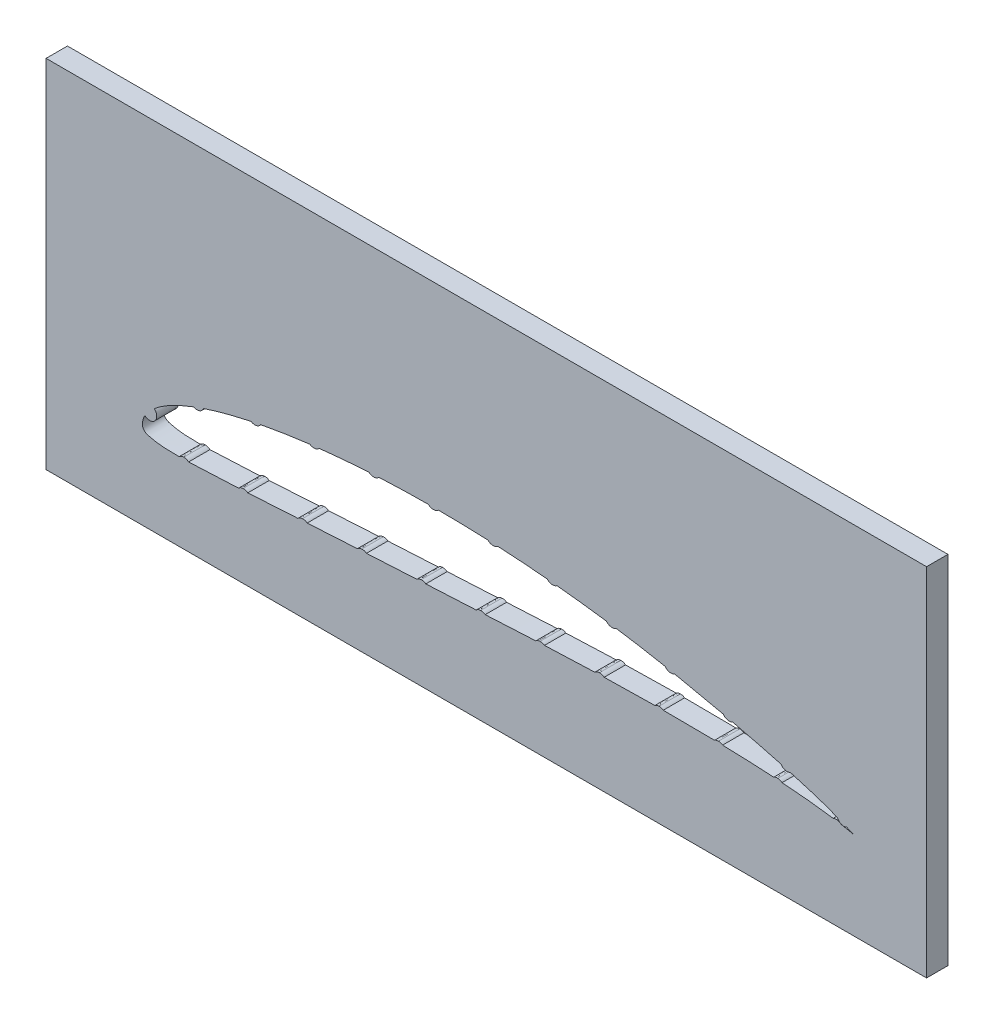
from build123d import *

# Parameters (mm, degrees)
SKETCH1_W           = 123.588543324
SKETCH1_H           = 50
BOSS_EXTRUDE2_DEPTH = 3
BOSS_EXTRUDE3_DEPTH = 3


with BuildPart() as part:
    # Sketch1 → Boss-Extrude2 (new body)
    with BuildSketch(Plane.XY):
        with Locations((218.267470168, 12.712423786)):
            Rectangle(SKETCH1_W, SKETCH1_H)
        with BuildLine():
            add(Edge.make_bspline(
                [(270, 0), (270.000531877, 0.003373113), (269.604790207, 0.130553943), (269.22472915, 0.296319344), (268.330865705, 0.649903004), (267.277186336, 1.081299428), (265.934274474, 1.592378679), (264.356085493, 2.13119545), (262.522264286, 2.690841421), (260.448213128, 3.281482663), (258.145825293, 3.901894754), (255.634156952, 4.543144793), (252.932846836, 5.198513494), (250.062314569, 5.858396716), (247.044177544, 6.51364444), (243.900590389, 7.151425674), (240.650956991, 7.760247697), (237.307066187, 8.31354205), (233.883595001, 8.806992825), (230.395260372, 9.240605966), (226.857180843, 9.602232354), (223.286591659, 9.896529908), (219.700248717, 10.117752504), (216.116964643, 10.261648713), (212.554817959, 10.334332115), (209.031451169, 10.328468466), (205.565142749, 10.247425168), (202.173482908, 10.093982453), (198.874572309, 9.868492566), (195.685665982, 9.575778452), (192.623683519, 9.217477093), (189.705290136, 8.796693592), (186.94527157, 8.320164438), (184.358265565, 7.789238681), (181.957578066, 7.210464766), (179.75475726, 6.590183358), (177.761781016, 5.931774723), (175.98567804, 5.247260918), (174.435455816, 4.534482769), (173.118173599, 3.799644912), (172.026756653, 3.064647529), (171.17127049, 2.318986898), (170.547770141, 1.590030804), (170.137458117, 0.884733652), (169.989560721, 0.227724311), (169.994733097, -0.383168635), (170.433396723, -0.862595631), (171.182072829, -1.059855632), (172.185532941, -1.264671848), (173.519915035, -1.359625351), (175.16301488, -1.38233033), (177.124973282, -1.338955474), (179.395715412, -1.244778023), (181.961254721, -1.11276071), (184.802106724, -0.95191893), (187.897230746, -0.767235246), (191.224075506, -0.567304184), (194.758064713, -0.356082726), (198.473361552, -0.140100109), (202.342623123, 0.077746338), (206.337292513, 0.293927277), (210.428851317, 0.506514505), (214.590287779, 0.719951626), (218.799226957, 0.941524586), (223.037430772, 1.162141782), (227.283652269, 1.371889531), (231.508516957, 1.545991012), (235.674820818, 1.672738516), (239.74464394, 1.755832522), (243.683325041, 1.792300885), (247.457889827, 1.78094482), (251.035666014, 1.722193168), (254.384683977, 1.617830293), (257.474550853, 1.472101348), (260.275209312, 1.290626327), (262.762715442, 1.080839711), (264.903324746, 0.855693179), (266.699603634, 0.617770387), (268.055136746, 0.401348582), (269.136474082, 0.181419843), (269.578077714, 0.103267656), (269.999462825, -0.003406717), (270, 0)],
                knots=[0, 0, 0, 0, 0.000978925, 0.003785915, 0.008178786, 0.013939636, 0.020914584, 0.029056598, 0.038413559, 0.048973972, 0.060645419, 0.073333851, 0.086939075, 0.101355023, 0.116470865, 0.132170767, 0.148332165, 0.164889948, 0.181806831, 0.198986829, 0.216369093, 0.233891214, 0.251455205, 0.268989944, 0.286410199, 0.30363306, 0.320588513, 0.33718727, 0.353353473, 0.369012335, 0.384083455, 0.398499749, 0.412191497, 0.425098469, 0.437171363, 0.448351495, 0.458605679, 0.467900991, 0.476215593, 0.483572991, 0.489970137, 0.495456444, 0.500131703, 0.503991848, 0.507230008, 0.509986767, 0.512500662, 0.516073685, 0.521095012, 0.527571392, 0.53558732, 0.545177111, 0.556301643, 0.568874715, 0.582800206, 0.597975202, 0.614286016, 0.631612678, 0.649825892, 0.668791608, 0.688371086, 0.708416853, 0.728796853, 0.749399049, 0.770145767, 0.790953093, 0.811664203, 0.832074041, 0.851999344, 0.871281672, 0.889760566, 0.907279934, 0.923686414, 0.93883251, 0.952579327, 0.964796492, 0.975364982, 0.984179192, 0.991107071, 0.996049394, 0.999011322, 1, 1, 1, 1], degree=3))
        make_face(mode=Mode.SUBTRACT)
    extrude(amount=BOSS_EXTRUDE2_DEPTH)

    # Sketch3 → Boss-Extrude3 (add)
    with BuildSketch(Plane.XY.offset(3)):
        with BuildLine():
            add(Edge.make_bspline(
                [(268.857308454, 2.303163111), (268.91819139, 2.275372315), (269.037830567, 2.220761481), (269.188402994, 2.093748198), (269.311683636, 1.941123122), (269.403448818, 1.764361273), (269.464568337, 1.574112157), (269.484143416, 1.376897811), (269.463271716, 1.178070249), (269.416998779, 1.052427732), (269.393366146, 0.988259265)],
                knots=[0, 0, 0, 0, 1.012081854, 1.988810785, 2.957856305, 3.975553384, 4.995284697, 5.973452278, 6.96499636, 8, 8, 8, 8], degree=3))
            add(Edge.make_bspline(
                [(269.393366146, 0.988259265), (269.364470212, 0.927575015), (269.308059731, 0.809107559), (269.183374926, 0.655606495), (269.029791525, 0.532103245), (268.852843041, 0.440033561), (268.663451384, 0.379024091), (268.46892997, 0.356330989), (268.27290157, 0.375807249), (268.149126007, 0.418365385), (268.085673839, 0.440182341)],
                knots=[0, 0, 0, 0, 1.022759203, 1.99662485, 2.987685297, 4.0104445, 5.023584258, 6.007909155, 6.978776747, 8, 8, 8, 8], degree=3))
            add(Edge.make_bspline(
                [(268.085673839, 0.440182341), (268.024858938, 0.468915894), (267.905677284, 0.52522631), (267.75373868, 0.652709948), (267.629590541, 0.806083896), (267.536470997, 0.983329193), (267.478741892, 1.1752859), (267.459337867, 1.371090048), (267.477324594, 1.568255205), (267.521912152, 1.691697127), (267.544808454, 1.755086188)],
                knots=[0, 0, 0, 0, 1.018905117, 1.996793456, 2.984119269, 4.003024386, 5.020399341, 6.011849183, 6.979058234, 8, 8, 8, 8], degree=3))
            add(Edge.make_bspline(
                [(267.544808454, 1.755086188), (267.574644724, 1.816487888), (267.633206371, 1.937005124), (267.757865991, 2.093165685), (267.9110445, 2.219158761), (268.0884646, 2.310781404), (268.277881191, 2.371636), (268.473512288, 2.391735414), (268.669540403, 2.370105791), (268.793884038, 2.325775053), (268.857308454, 2.303163111)],
                knots=[0, 0, 0, 0, 1.032958572, 2.027457061, 3.003065255, 4.019594588, 5.038155821, 6.003109628, 6.981438767, 8, 8, 8, 8], degree=3))
        make_face()
        with BuildLine():
            add(Edge.make_bspline(
                [(260.754051269, 5.000651016), (260.816781439, 4.978984283), (260.940584814, 4.936223125), (261.106600422, 4.83152613), (261.244088529, 4.691610026), (261.354851334, 4.527598847), (261.438216247, 4.34618228), (261.479530121, 4.152728215), (261.480182032, 3.953473503), (261.449836098, 3.823986178), (261.434339731, 3.757862555)],
                knots=[0, 0, 0, 0, 1.008745825, 1.990846472, 2.957578748, 3.976685275, 4.993009952, 5.979425217, 6.968179124, 8, 8, 8, 8], degree=3))
            add(Edge.make_bspline(
                [(261.434339731, 3.757862555), (261.412817767, 3.694259582), (261.370576145, 3.569424658), (261.264505578, 3.402732027), (261.12547897, 3.263223468), (260.962038828, 3.149355535), (260.780138236, 3.067685856), (260.589217387, 3.022547519), (260.392153631, 3.019693192), (260.264102838, 3.04846813), (260.198762808, 3.063151016)],
                knots=[0, 0, 0, 0, 1.021235543, 2.004400996, 2.980860545, 4.008001129, 5.025427718, 6.003644384, 6.981326609, 8, 8, 8, 8], degree=3))
            add(Edge.make_bspline(
                [(260.198762808, 3.063151016), (260.135163114, 3.085531859), (260.011239348, 3.129140848), (259.844933901, 3.23605512), (259.707218052, 3.37615138), (259.594332209, 3.540905186), (259.515539064, 3.724874722), (259.473878292, 3.917406717), (259.469998257, 4.114918031), (259.498912622, 4.242991648), (259.513666654, 4.308343324)],
                knots=[0, 0, 0, 0, 1.02422911, 1.995706581, 2.979369884, 3.998132512, 5.020397056, 6.006479454, 6.982773251, 8, 8, 8, 8], degree=3))
            add(Edge.make_bspline(
                [(259.513666654, 4.308343324), (259.536186438, 4.372652734), (259.580280606, 4.498571788), (259.685093191, 4.66787202), (259.824311154, 4.808058023), (259.989211273, 4.918594492), (260.170517652, 5.002387115), (260.363209608, 5.04240894), (260.560854521, 5.047383003), (260.688729721, 5.016451519), (260.754051269, 5.000651016)],
                knots=[0, 0, 0, 0, 1.033077547, 2.022785576, 2.995503267, 4.011805204, 5.025332947, 6.009033588, 6.982969271, 8, 8, 8, 8], degree=3))
        make_face()
        with BuildLine():
            add(Edge.make_bspline(
                [(252.583229116, 7.076790794), (252.647443863, 7.057555753), (252.773670516, 7.019745516), (252.945666386, 6.922135896), (253.08881602, 6.787835684), (253.209100734, 6.630142473), (253.29768104, 6.452410142), (253.346977381, 6.261757516), (253.357725723, 6.063449193), (253.333564024, 5.932306841), (253.321209885, 5.865252332)],
                knots=[0, 0, 0, 0, 1.01808493, 2.00124515, 2.97658461, 3.986309412, 5.006145636, 5.976287325, 6.965253734, 8, 8, 8, 8], degree=3))
            add(Edge.make_bspline(
                [(253.321209885, 5.865252332), (253.302194424, 5.800887056), (253.265013221, 5.675032707), (253.164824234, 5.505646368), (253.034940126, 5.358001156), (252.874760322, 5.237926411), (252.697136411, 5.146175683), (252.50728611, 5.093908111), (252.310235069, 5.083664832), (252.180721901, 5.107744083), (252.114479116, 5.120060025)],
                knots=[0, 0, 0, 0, 1.019133022, 1.992725439, 2.969984308, 3.997852915, 5.024198162, 5.99847909, 6.976271501, 8, 8, 8, 8], degree=3))
            add(Edge.make_bspline(
                [(252.114479116, 5.120060025), (252.050052567, 5.13895852), (251.92474481, 5.175715542), (251.756262829, 5.277233024), (251.610407324, 5.407473615), (251.493196968, 5.569637409), (251.408317814, 5.750223877), (251.355127125, 5.940312451), (251.344842853, 6.137489401), (251.369014526, 6.266165526), (251.381306039, 6.331598486)],
                knots=[0, 0, 0, 0, 1.021315902, 1.986429638, 2.973923132, 3.989360908, 5.018122711, 6.006297939, 6.986184684, 8, 8, 8, 8], degree=3))
            add(Edge.make_bspline(
                [(251.381306039, 6.331598486), (251.400572733, 6.396575743), (251.438435004, 6.524266898), (251.535205894, 6.698490363), (251.670316089, 6.841968701), (251.827448469, 6.961771627), (252.004224355, 7.050655228), (252.192768019, 7.102990466), (252.389108524, 7.113259181), (252.517792277, 7.089084059), (252.583229116, 7.076790794)],
                knots=[0, 0, 0, 0, 1.032464466, 2.028965024, 3.006987829, 4.019490577, 5.031180752, 6.00713739, 6.986611552, 8, 8, 8, 8], degree=3))
        make_face()
        with BuildLine():
            add(Edge.make_bspline(
                [(244.367056173, 8.838395658), (244.431974217, 8.821587782), (244.559121029, 8.788668308), (244.734586392, 8.698073184), (244.882574294, 8.56895987), (245.007436307, 8.413853177), (245.099407078, 8.236982448), (245.161235775, 8.048775643), (245.174360031, 7.849624938), (245.15551179, 7.718001623), (245.145902327, 7.650895658)],
                knots=[0, 0, 0, 0, 1.017037865, 1.991944219, 2.967990593, 3.98159658, 5.000164099, 5.982268228, 6.971292906, 8, 8, 8, 8], degree=3))
            add(Edge.make_bspline(
                [(245.145902327, 7.650895658), (245.129345869, 7.585832209), (245.096826238, 7.458036803), (245.002046726, 7.283812167), (244.874557347, 7.132703085), (244.719279419, 7.007118404), (244.545786729, 6.909664703), (244.3578865, 6.854491638), (244.162304494, 6.832022771), (244.031995726, 6.852170479), (243.965613866, 6.862434119)],
                knots=[0, 0, 0, 0, 1.019544405, 2.002554324, 2.990327538, 4.014101528, 5.030205597, 5.999477124, 6.98089414, 8, 8, 8, 8], degree=3))
            add(Edge.make_bspline(
                [(243.965613866, 6.862434119), (243.900427471, 6.87879686), (243.773077596, 6.910763545), (243.601586848, 7.007453507), (243.448225133, 7.130602373), (243.32661188, 7.289625063), (243.231518471, 7.466206534), (243.176121615, 7.656053254), (243.157110349, 7.853374477), (243.176754759, 7.983571426), (243.186767712, 8.049934119)],
                knots=[0, 0, 0, 0, 1.018198843, 1.989180332, 2.967860581, 3.992171291, 5.011901535, 6.003255219, 6.982239123, 8, 8, 8, 8], degree=3))
            add(Edge.make_bspline(
                [(243.186767712, 8.049934119), (243.203305045, 8.115803417), (243.235779095, 8.245149721), (243.330204649, 8.420517361), (243.455031231, 8.57348442), (243.611597388, 8.697276608), (243.78747213, 8.789231578), (243.974043509, 8.850553298), (244.170611118, 8.867689371), (244.300732167, 8.848285835), (244.367056173, 8.838395658)],
                knots=[0, 0, 0, 0, 1.029383351, 2.021380768, 2.999587737, 4.013860053, 5.033097165, 6.004220827, 6.982731304, 8, 8, 8, 8], degree=3))
        make_face()
        with BuildLine():
            add(Edge.make_bspline(
                [(236.064273131, 10.250935141), (236.129996129, 10.237611793), (236.258442035, 10.211573275), (236.436356565, 10.126392393), (236.592355078, 10.006583929), (236.722771552, 9.855017928), (236.8262947, 9.684027813), (236.893303129, 9.497926905), (236.918372617, 9.299949457), (236.903596433, 9.167533107), (236.8960039, 9.099492833)],
                knots=[0, 0, 0, 0, 1.014931213, 1.983533345, 2.964055081, 3.981389191, 5.00155579, 5.982681017, 6.963429105, 8, 8, 8, 8], degree=3))
            add(Edge.make_bspline(
                [(236.8960039, 9.099492833), (236.882542452, 9.033840586), (236.856087961, 8.904820517), (236.77231449, 8.725307764), (236.650781526, 8.569179712), (236.501083176, 8.435737128), (236.329038874, 8.333908018), (236.145123695, 8.262769642), (235.949212932, 8.23587301), (235.818225142, 8.249055277), (235.751773131, 8.255742833)],
                knots=[0, 0, 0, 0, 1.016417799, 1.997468461, 2.979426383, 4.006303523, 5.027964377, 6.003249458, 6.98701939, 8, 8, 8, 8], degree=3))
            add(Edge.make_bspline(
                [(235.751773131, 8.255742833), (235.685986293, 8.269832911), (235.557259983, 8.297403225), (235.380298711, 8.385457581), (235.223514988, 8.504714266), (235.093647289, 8.656620655), (234.9882002, 8.827468538), (234.927288892, 9.015310106), (234.897079678, 9.211108975), (234.910664386, 9.34225905), (234.917638515, 9.409588987)],
                knots=[0, 0, 0, 0, 1.018889088, 1.993678927, 2.97513822, 3.993445086, 5.01458715, 6.004170248, 6.97537923, 8, 8, 8, 8], degree=3))
            add(Edge.make_bspline(
                [(234.917638515, 9.409588987), (234.931841548, 9.476118685), (234.959780028, 9.606987821), (235.046234796, 9.786564127), (235.164157192, 9.945655105), (235.316104694, 10.075244668), (235.486340645, 10.178184666), (235.671308803, 10.246356157), (235.866963225, 10.270177609), (235.99782984, 10.257414962), (236.064273131, 10.250935141)],
                knots=[0, 0, 0, 0, 1.029942136, 2.025976994, 2.999384555, 4.016962166, 5.037372944, 6.007276013, 6.988258845, 8, 8, 8, 8], degree=3))
        make_face()
        with BuildLine():
            add(Edge.make_bspline(
                [(227.677139671, 11.255114558), (227.742825795, 11.245197617), (227.871607989, 11.225754767), (228.050468642, 11.146712024), (228.212855226, 11.038427248), (228.346762153, 10.892506175), (228.458882801, 10.729516834), (228.531621436, 10.546573992), (228.570795189, 10.351948741), (228.561611968, 10.219185888), (228.556947364, 10.151749174)],
                knots=[0, 0, 0, 0, 1.011967132, 1.984031631, 2.963102508, 3.97744202, 4.993852823, 5.972540036, 6.970154417, 8, 8, 8, 8], degree=3))
            add(Edge.make_bspline(
                [(228.556947364, 10.151749174), (228.547152926, 10.085221545), (228.528060753, 9.955540092), (228.447916874, 9.775612483), (228.340483865, 9.611280349), (228.19438642, 9.475113774), (228.032575538, 9.360784781), (227.851572601, 9.287931836), (227.660289051, 9.248922001), (227.529851997, 9.256202065), (227.463197364, 9.259922251)],
                knots=[0, 0, 0, 0, 1.025326729, 1.998656239, 2.989165282, 4.013316177, 5.037908168, 6.006506537, 6.98130499, 8, 8, 8, 8], degree=3))
            add(Edge.make_bspline(
                [(227.463197364, 9.259922251), (227.396741568, 9.270761901), (227.26734874, 9.291867254), (227.087285126, 9.37045509), (226.925200546, 9.479877957), (226.787733304, 9.624271033), (226.677678159, 9.790128688), (226.603241809, 9.972164786), (226.568546795, 10.165746935), (226.57519922, 10.296698654), (226.578581979, 10.363287635)],
                knots=[0, 0, 0, 0, 1.025589576, 1.996875291, 2.97516177, 3.997162156, 5.022971071, 6.000874194, 6.983444043, 8, 8, 8, 8], degree=3))
            add(Edge.make_bspline(
                [(226.578581979, 10.363287635), (226.589582149, 10.430461124), (226.611119114, 10.561978462), (226.687694259, 10.745464793), (226.798671529, 10.907678245), (226.940286665, 11.045851912), (227.10441135, 11.156847919), (227.286341937, 11.229434316), (227.479319727, 11.269015421), (227.610500678, 11.259797299), (227.677139671, 11.255114558)],
                knots=[0, 0, 0, 0, 1.035250362, 2.026891483, 3.002977376, 4.013929038, 5.027241016, 6.002944416, 6.985509923, 8, 8, 8, 8], degree=3))
        make_face()
        with BuildLine():
            add(Edge.make_bspline(
                [(219.281392129, 11.869580378), (219.347690114, 11.862838474), (219.478782443, 11.849507571), (219.662825313, 11.779775248), (219.829037668, 11.675408234), (219.972901039, 11.538993422), (220.094656457, 11.37975887), (220.176672003, 11.198947938), (220.222821404, 11.004108536), (220.220222748, 10.870622854), (220.218892129, 10.802272686)],
                knots=[0, 0, 0, 0, 1.008322197, 1.993775624, 2.955893755, 3.971675897, 4.988841592, 5.979688237, 6.965517146, 8, 8, 8, 8], degree=3))
            add(Edge.make_bspline(
                [(220.218892129, 10.802272686), (220.212177574, 10.735961216), (220.198900751, 10.604842222), (220.128527916, 10.420351802), (220.02480676, 10.252413657), (219.889124968, 10.105909433), (219.729443431, 9.985031315), (219.550829189, 9.901941918), (219.358984032, 9.85682263), (219.227932504, 9.857311971), (219.161199821, 9.857561148)],
                knots=[0, 0, 0, 0, 1.011814065, 2.000680165, 2.976496362, 4.004750697, 5.025438885, 6.008635918, 6.985978499, 8, 8, 8, 8], degree=3))
            add(Edge.make_bspline(
                [(219.161199821, 9.857561148), (219.095000936, 9.865465694), (218.965244063, 9.880959448), (218.779841468, 9.947382934), (218.614895376, 10.054069569), (218.468423273, 10.189774894), (218.352139689, 10.352318764), (218.267847418, 10.530260508), (218.223022005, 10.722321524), (218.223471125, 10.853343509), (218.223699821, 10.920061148)],
                knots=[0, 0, 0, 0, 1.015388815, 1.990270343, 2.97423849, 3.995282884, 5.020347872, 6.005227664, 6.984242983, 8, 8, 8, 8], degree=3))
            add(Edge.make_bspline(
                [(218.223699821, 10.920061148), (218.231609479, 10.987855999), (218.247112087, 11.120731171), (218.312804476, 11.309045822), (218.417345164, 11.476932284), (218.554269738, 11.62123315), (218.713063371, 11.742201719), (218.891784932, 11.825175781), (219.083602147, 11.870325099), (219.214657499, 11.869831648), (219.281392129, 11.869580378)],
                knots=[0, 0, 0, 0, 1.034626547, 2.027826264, 3.000679092, 4.016883515, 5.034472066, 6.014683315, 6.989057891, 8, 8, 8, 8], degree=3))
        make_face()
        with BuildLine():
            add(Edge.make_bspline(
                [(210.850616037, 12.060053954), (210.917504228, 12.055387826), (211.048009775, 12.046283746), (211.236210276, 11.989331274), (211.406713501, 11.893405673), (211.55728221, 11.763734795), (211.680804036, 11.608233903), (211.776509514, 11.435610031), (211.826846099, 11.242311969), (211.833021433, 11.109191284), (211.83619296, 11.040823184)],
                knots=[0, 0, 0, 0, 1.018387724, 1.986976232, 2.964434224, 3.976593219, 4.991981267, 5.974298486, 6.959640553, 8, 8, 8, 8], degree=3))
            add(Edge.make_bspline(
                [(211.83619296, 11.040823184), (211.831555736, 10.973919611), (211.822508048, 10.843384052), (211.764940715, 10.654724004), (211.669740517, 10.482320007), (211.539807874, 10.329792889), (211.386266813, 10.203275112), (211.213103795, 10.111424693), (211.024607363, 10.056638854), (210.893447435, 10.050940129), (210.826577575, 10.048034723)],
                knots=[0, 0, 0, 0, 1.021154089, 1.992373686, 2.983189672, 4.007415787, 5.033247389, 6.001690304, 6.981192721, 8, 8, 8, 8], degree=3))
            add(Edge.make_bspline(
                [(210.826577575, 10.048034723), (210.759606046, 10.052439054), (210.62870093, 10.06104793), (210.441464835, 10.121859492), (210.270317102, 10.216818344), (210.120293247, 10.346990616), (209.994832279, 10.501873507), (209.90548164, 10.677290307), (209.849424887, 10.866745039), (209.843845312, 10.997962469), (209.841000652, 11.064861646)],
                knots=[0, 0, 0, 0, 1.021460431, 1.996585683, 2.976992887, 3.992205795, 5.010657499, 6.00109082, 6.980887083, 8, 8, 8, 8], degree=3))
            add(Edge.make_bspline(
                [(209.841000652, 11.064861646), (209.845594196, 11.133362144), (209.854506479, 11.26626517), (209.911778165, 11.457506078), (210.006904607, 11.630191337), (210.13735309, 11.781178592), (210.292418985, 11.903933325), (210.462876532, 12.000424602), (210.653133761, 12.050480669), (210.783858277, 12.056817759), (210.850616037, 12.060053954)],
                knots=[0, 0, 0, 0, 1.042672751, 2.022968706, 3.011126506, 4.023312124, 5.038726881, 6.010331962, 6.983926002, 8, 8, 8, 8], degree=3))
        make_face()
        with BuildLine():
            add(Edge.make_bspline(
                [(202.417979309, 11.826563664), (202.484786782, 11.826219032), (202.616333064, 11.825540438), (202.806324677, 11.775165833), (202.982225703, 11.688739921), (203.138104165, 11.566028641), (203.272781412, 11.419292555), (203.373914037, 11.24943259), (203.438486966, 11.060883956), (203.45037396, 10.928025733), (203.456440847, 10.860217511)],
                knots=[0, 0, 0, 0, 1.013395961, 1.995412564, 2.960779728, 3.977984359, 4.996869055, 5.975699992, 6.966837105, 8, 8, 8, 8], degree=3))
            add(Edge.make_bspline(
                [(203.456440847, 10.860217511), (203.456121875, 10.793399603), (203.455493808, 10.661832776), (203.404563588, 10.471288433), (203.318742382, 10.293671169), (203.196774443, 10.136191043), (203.050706851, 10.000208406), (202.88355955, 9.897904003), (202.697345517, 9.832156874), (202.566748737, 9.820518637), (202.499710078, 9.814544434)],
                knots=[0, 0, 0, 0, 1.015588309, 1.999729374, 2.978162138, 4.007265433, 5.019317663, 6.006565314, 6.976719118, 8, 8, 8, 8], degree=3))
            add(Edge.make_bspline(
                [(202.499710078, 9.814544434), (202.432913642, 9.814913513), (202.301389093, 9.815640242), (202.110189421, 9.865940549), (201.934047182, 9.954492725), (201.777443179, 10.07754388), (201.641137927, 10.223804347), (201.546097674, 10.395627444), (201.478456226, 10.580620843), (201.467085449, 10.71136991), (201.461248539, 10.778486741)],
                knots=[0, 0, 0, 0, 1.015226607, 1.999017171, 2.982504237, 4.001546395, 5.022271652, 6.007275275, 6.97708356, 8, 8, 8, 8], degree=3))
            add(Edge.make_bspline(
                [(201.461248539, 10.778486741), (201.461537468, 10.84689556), (201.462103094, 10.980817689), (201.512582365, 11.173994447), (201.598640265, 11.35109925), (201.719244263, 11.508933986), (201.866206745, 11.642917421), (202.034770466, 11.742863728), (202.220278435, 11.809078152), (202.350918454, 11.820632515), (202.417979309, 11.826563664)],
                knots=[0, 0, 0, 0, 1.037168643, 2.030437559, 3.006202568, 4.015421778, 5.033726636, 6.012000531, 6.979509154, 8, 8, 8, 8], degree=3))
        make_face()
        with BuildLine():
            add(Edge.make_bspline(
                [(193.955212157, 11.143162179), (194.021750666, 11.147342657), (194.15166347, 11.155504812), (194.345022925, 11.123683849), (194.525162849, 11.048352923), (194.692059785, 10.941724951), (194.836160657, 10.804425517), (194.951932764, 10.645156171), (195.028143535, 10.46100912), (195.051417304, 10.330477151), (195.063385234, 10.263354486)],
                knots=[0, 0, 0, 0, 1.015414257, 1.982540864, 2.95913311, 3.976901612, 4.98906984, 5.980030657, 6.961283373, 8, 8, 8, 8], degree=3))
            add(Edge.make_bspline(
                [(195.063385234, 10.263354486), (195.067525252, 10.196815518), (195.075657608, 10.066111144), (195.04389645, 9.871231898), (194.968698618, 9.688602672), (194.861843254, 9.519685044), (194.726515335, 9.373084226), (194.566470894, 9.260537105), (194.387828635, 9.179875457), (194.258880779, 9.158737728), (194.193192926, 9.147969871)],
                knots=[0, 0, 0, 0, 1.016345316, 1.996435784, 2.985278933, 4.014299292, 5.036305514, 6.011106652, 6.986829732, 8, 8, 8, 8], degree=3))
            add(Edge.make_bspline(
                [(194.193192926, 9.147969871), (194.126655907, 9.14384284), (193.995955363, 9.135735996), (193.801789488, 9.167190395), (193.620105851, 9.242474234), (193.454045484, 9.352163675), (193.309891319, 9.490467173), (193.198147148, 9.651640761), (193.11645781, 9.831410575), (193.095670351, 9.961252669), (193.085019849, 10.027777563)],
                knots=[0, 0, 0, 0, 1.015512743, 1.994800338, 2.971487305, 3.996020487, 5.016749877, 6.000762099, 6.975685884, 8, 8, 8, 8], degree=3))
            add(Edge.make_bspline(
                [(193.085019849, 10.027777563), (193.079410816, 10.095997671), (193.068510748, 10.228570202), (193.106286564, 10.423768345), (193.175208345, 10.607036359), (193.285170739, 10.772075222), (193.420996938, 10.915148328), (193.578547372, 11.032431246), (193.761008978, 11.107033864), (193.889755963, 11.130985128), (193.955212157, 11.143162179)],
                knots=[0, 0, 0, 0, 1.040004898, 2.021047546, 3.004297608, 4.011584217, 5.023535757, 6.004349767, 6.985392415, 8, 8, 8, 8], degree=3))
        make_face()
        with BuildLine():
            add(Edge.make_bspline(
                [(185.591222589, 9.805177253), (185.657586202, 9.815420881), (185.787068244, 9.835407223), (185.982332252, 9.813602267), (186.168538229, 9.754835005), (186.342477691, 9.658233484), (186.497638079, 9.533096965), (186.623793824, 9.380800781), (186.71471013, 9.204001947), (186.747536225, 9.075252567), (186.764299513, 9.009504176)],
                knots=[0, 0, 0, 0, 1.019042273, 1.988253323, 2.96107011, 3.97711078, 5.000820892, 5.980733335, 6.96882195, 8, 8, 8, 8], degree=3))
            add(Edge.make_bspline(
                [(186.764299513, 9.009504176), (186.773181734, 8.943150433), (186.790618201, 8.812893065), (186.774051407, 8.616590137), (186.713178002, 8.429241054), (186.618000583, 8.25462699), (186.494839762, 8.098212465), (186.344201609, 7.972648863), (186.171132623, 7.878259658), (186.043316047, 7.845761328), (185.97824182, 7.829215714)],
                knots=[0, 0, 0, 0, 1.019508912, 2.001372377, 2.975823716, 4.004310757, 5.022058604, 5.994206091, 6.978806251, 8, 8, 8, 8], degree=3))
            add(Edge.make_bspline(
                [(185.97824182, 7.829215714), (185.911845624, 7.819968281), (185.782222857, 7.80191487), (185.586494003, 7.823429614), (185.399034295, 7.881350527), (185.224957726, 7.978871202), (185.068008746, 8.102798723), (184.948025298, 8.259368569), (184.850986328, 8.431352848), (184.820606348, 8.559668746), (184.805164897, 8.624888791)],
                knots=[0, 0, 0, 0, 1.018824193, 1.989011705, 2.974466676, 3.991530988, 5.016272468, 5.998996802, 6.982935689, 8, 8, 8, 8], degree=3))
            add(Edge.make_bspline(
                [(184.805164897, 8.624888791), (184.794894854, 8.692077047), (184.774730003, 8.82399871), (184.797306553, 9.021883254), (184.851831011, 9.21165556), (184.949908428, 9.385753318), (185.074675439, 9.540154346), (185.224563642, 9.666937395), (185.398689045, 9.758435938), (185.526217439, 9.789395971), (185.591222589, 9.805177253)],
                knots=[0, 0, 0, 0, 1.030001708, 2.022370363, 3.002151597, 4.017033193, 5.039575484, 6.008985142, 6.985118403, 8, 8, 8, 8], degree=3))
        make_face()
        with BuildLine():
            add(Edge.make_bspline(
                [(177.324022904, 7.525462819), (177.388396364, 7.544404793), (177.514538198, 7.581522193), (177.710756817, 7.586749631), (177.903284766, 7.555824888), (178.086097385, 7.481618032), (178.257045297, 7.380979603), (178.401177838, 7.246440777), (178.514821597, 7.08356133), (178.565087508, 6.960916821), (178.590849827, 6.898058973)],
                knots=[0, 0, 0, 0, 1.020740959, 2.000174248, 2.967614024, 3.978630612, 4.994152611, 5.980969911, 6.965205307, 8, 8, 8, 8], degree=3))
            add(Edge.make_bspline(
                [(178.590849827, 6.898058973), (178.609783789, 6.833692338), (178.646885487, 6.70756388), (178.652248295, 6.510449989), (178.620462333, 6.317065518), (178.550737482, 6.131146852), (178.448525671, 5.960938346), (178.316157793, 5.816484026), (178.157560346, 5.69940349), (178.035320373, 5.651051097), (177.973061365, 5.626424357)],
                knots=[0, 0, 0, 0, 1.021791598, 2.002233008, 2.982750905, 4.001896892, 5.018464159, 5.997987266, 6.98033905, 8, 8, 8, 8], degree=3))
            add(Edge.make_bspline(
                [(177.973061365, 5.626424357), (177.908639464, 5.60848744), (177.783002578, 5.573506504), (177.587159666, 5.5674873), (177.39394272, 5.59870054), (177.208564758, 5.671755069), (177.038113291, 5.775136648), (176.897026566, 5.911550141), (176.779015757, 6.069123752), (176.730794428, 6.19149986), (176.706234442, 6.253828203)],
                knots=[0, 0, 0, 0, 1.019560782, 1.988367927, 2.969497438, 3.993614118, 5.017217438, 5.996738476, 6.97970302, 8, 8, 8, 8], degree=3))
            add(Edge.make_bspline(
                [(176.706234442, 6.253828203), (176.687582052, 6.319022248), (176.651007662, 6.446857468), (176.641696195, 6.645280488), (176.673705966, 6.840255534), (176.747173257, 7.024775569), (176.847448183, 7.196622509), (176.983372965, 7.336375573), (177.140393022, 7.453033972), (177.26170458, 7.5008827), (177.324022904, 7.525462819)],
                knots=[0, 0, 0, 0, 1.0322296, 2.024039123, 3.003175911, 4.025212558, 5.040347938, 6.017879519, 6.981775295, 8, 8, 8, 8], degree=3))
        make_face()
        with BuildLine():
            add(Edge.make_bspline(
                [(170.194519118, 2.555370385), (170.236647443, 2.606952558), (170.319034962, 2.707828329), (170.475126849, 2.825705381), (170.651931123, 2.908851768), (170.844903303, 2.955231149), (171.043714144, 2.968184773), (171.239630982, 2.942171921), (171.426067478, 2.873320269), (171.537083507, 2.801195177), (171.59355758, 2.764505001)],
                knots=[0, 0, 0, 0, 1.013973166, 1.98295882, 2.95710545, 3.977846359, 4.995135459, 5.983089641, 6.973993736, 8, 8, 8, 8], degree=3))
            add(Edge.make_bspline(
                [(171.59355758, 2.764505001), (171.646235425, 2.722625553), (171.749304524, 2.64068452), (171.865650542, 2.480588963), (171.952333411, 2.303610323), (171.997080108, 2.109169169), (172.014928262, 1.911274025), (171.985943082, 1.717980809), (171.924756507, 1.531862566), (171.851935321, 1.423342449), (171.814711426, 1.367870385)],
                knots=[0, 0, 0, 0, 1.02396448, 2.003481677, 2.994713637, 4.01625956, 5.03516051, 6.011765435, 6.983677152, 8, 8, 8, 8], degree=3))
            add(Edge.make_bspline(
                [(171.814711426, 1.367870385), (171.77252033, 1.316373951), (171.689296499, 1.21479492), (171.532333413, 1.094835601), (171.352985837, 1.0124804), (171.159638767, 0.965846786), (170.961136755, 0.951432937), (170.767275833, 0.98300865), (170.5806836, 1.046113754), (170.471201077, 1.119242151), (170.415672964, 1.156331924)],
                knots=[0, 0, 0, 0, 1.013564952, 1.99930241, 2.984129115, 4.004459085, 5.021338636, 5.998542729, 6.984886888, 8, 8, 8, 8], degree=3))
            add(Edge.make_bspline(
                [(170.415672964, 1.156331924), (170.363270862, 1.199252384), (170.26075891, 1.283215811), (170.141245444, 1.441222797), (170.055045095, 1.618273688), (170.005694093, 1.811178623), (169.99305246, 2.009676971), (170.020330956, 2.204000027), (170.084535267, 2.390328024), (170.157508197, 2.499831597), (170.194519118, 2.555370385)],
                knots=[0, 0, 0, 0, 1.02919371, 2.013366866, 2.990852128, 4.012558579, 5.027824409, 6.001718911, 6.986497806, 8, 8, 8, 8], degree=3))
        make_face()
        with BuildLine():
            add(Edge.make_bspline(
                [(175.839971178, -3.117304511), (175.773045339, -3.115497029), (175.641715246, -3.111950165), (175.453570967, -3.055119774), (175.278434376, -2.967968614), (175.12364754, -2.842661749), (174.995168045, -2.690552419), (174.898126082, -2.518105713), (174.839025038, -2.327766115), (174.830091902, -2.194635977), (174.825548101, -2.126919896)],
                knots=[0, 0, 0, 0, 1.014678471, 1.991126599, 2.961771574, 3.976743051, 4.997775421, 5.974832402, 6.969907072, 8, 8, 8, 8], degree=3))
            add(Edge.make_bspline(
                [(174.825548101, -2.126919896), (174.827317734, -2.059973021), (174.830790326, -1.928601648), (174.888371576, -1.740066726), (174.973937136, -1.563205405), (175.100873653, -1.408979022), (175.249526924, -1.277522641), (175.418615392, -1.178098865), (175.606161927, -1.118540522), (175.736984292, -1.109771529), (175.803913486, -1.105285281)],
                knots=[0, 0, 0, 0, 1.018549086, 1.998721994, 2.98400179, 4.002844999, 5.026455867, 6.002646806, 6.978146908, 8, 8, 8, 8], degree=3))
            add(Edge.make_bspline(
                [(175.803913486, -1.105285281), (175.870816897, -1.107141453), (176.002102982, -1.110783862), (176.190921908, -1.167025365), (176.365576647, -1.257317004), (176.519728436, -1.384601494), (176.648450938, -1.537431162), (176.747513602, -1.707351357), (176.807537892, -1.895500709), (176.816272005, -2.026332192), (176.820740409, -2.09326605)],
                knots=[0, 0, 0, 0, 1.016734348, 1.995160892, 2.973358556, 3.998063399, 5.021164519, 6.006205468, 6.979967532, 8, 8, 8, 8], degree=3))
            add(Edge.make_bspline(
                [(176.820740409, -2.09326605), (176.818948935, -2.161774756), (176.815453621, -2.29544092), (176.759038802, -2.487402343), (176.669293244, -2.663430221), (176.543906452, -2.818448015), (176.394164236, -2.947707295), (176.224640607, -3.044107251), (176.037787577, -3.104182973), (175.906922317, -3.112863515), (175.839971178, -3.117304511)],
                knots=[0, 0, 0, 0, 1.039375622, 2.027907958, 3.015310844, 4.030646385, 5.04275304, 6.009523282, 6.981664938, 8, 8, 8, 8], degree=3))
        make_face()
        with BuildLine():
            add(Edge.make_bspline(
                [(184.237302611, -2.759311341), (184.170517818, -2.759797468), (184.039178386, -2.760753489), (183.848616884, -2.712298117), (183.67080684, -2.629052853), (183.512862484, -2.508404668), (183.374373279, -2.364705074), (183.274826892, -2.193564267), (183.206981314, -2.006026211), (183.193628738, -1.872866681), (183.186821842, -1.804984418)],
                knots=[0, 0, 0, 0, 1.011688187, 1.989592912, 2.959499061, 3.977838594, 4.994792978, 5.972470081, 6.966402781, 8, 8, 8, 8], degree=3))
            add(Edge.make_bspline(
                [(183.186821842, -1.804984418), (183.186304453, -1.738187024), (183.185286953, -1.606822814), (183.234372648, -1.415732461), (183.316400888, -1.236641494), (183.437526209, -1.077717722), (183.582569387, -0.941223611), (183.748429419, -0.8342885), (183.934708318, -0.768105711), (184.065333962, -0.75429248), (184.131533381, -0.74729211)],
                knots=[0, 0, 0, 0, 1.014505969, 1.995134382, 2.978801155, 3.999976997, 5.019763831, 6.002520082, 6.987702522, 8, 8, 8, 8], degree=3))
            add(Edge.make_bspline(
                [(184.131533381, -0.74729211), (184.198298099, -0.746854866), (184.329598051, -0.74599498), (184.520786735, -0.793834611), (184.698212718, -0.880214149), (184.85526437, -1.003040076), (184.994672791, -1.146567518), (185.092781312, -1.316712632), (185.162346948, -1.501110931), (185.175348437, -1.632072641), (185.18201415, -1.699215187)],
                knots=[0, 0, 0, 0, 1.014531168, 1.995183938, 2.973094045, 4.001647616, 5.02145978, 6.001884288, 6.975589297, 8, 8, 8, 8], degree=3))
            add(Edge.make_bspline(
                [(185.18201415, -1.699215187), (185.18256519, -1.767609283), (185.183642648, -1.901341574), (185.134938442, -2.094976646), (185.052449363, -2.274856546), (184.931088253, -2.433319209), (184.787732222, -2.570981266), (184.618849247, -2.671381135), (184.434323746, -2.738814304), (184.303567976, -2.752417443), (184.237302611, -2.759311341)],
                knots=[0, 0, 0, 0, 1.035884002, 2.025483881, 3.006275766, 4.024467094, 5.041273474, 6.008357966, 6.990661087, 8, 8, 8, 8], degree=3))
        make_face()
        with BuildLine():
            add(Edge.make_bspline(
                [(192.569480106, -2.261674357), (192.502695313, -2.262160484), (192.371355881, -2.263116506), (192.180794379, -2.214661133), (192.002984335, -2.13141587), (191.845039979, -2.010767684), (191.706550774, -1.867068091), (191.607004387, -1.695927283), (191.539158809, -1.508389227), (191.525806233, -1.375229697), (191.518999337, -1.307347434)],
                knots=[0, 0, 0, 0, 1.011688187, 1.989592912, 2.959499061, 3.977838594, 4.994792978, 5.972470081, 6.966402781, 8, 8, 8, 8], degree=3))
            add(Edge.make_bspline(
                [(191.518999337, -1.307347434), (191.518481948, -1.240550041), (191.517464448, -1.10918583), (191.566550143, -0.918095477), (191.648578383, -0.73900451), (191.769703704, -0.580080738), (191.914746882, -0.443586627), (192.080606914, -0.336651516), (192.266885813, -0.270468727), (192.397511457, -0.256655496), (192.463710876, -0.249655126)],
                knots=[0, 0, 0, 0, 1.014505969, 1.995134382, 2.978801155, 3.999976997, 5.019763831, 6.002520082, 6.987702522, 8, 8, 8, 8], degree=3))
            add(Edge.make_bspline(
                [(192.463710876, -0.249655126), (192.530475594, -0.249217883), (192.661775545, -0.248357996), (192.85296423, -0.296197627), (193.030390213, -0.382577165), (193.187441865, -0.505403093), (193.326850286, -0.648930534), (193.424958807, -0.819075649), (193.494524443, -1.003473948), (193.507525932, -1.134435657), (193.514191645, -1.201578203)],
                knots=[0, 0, 0, 0, 1.014531168, 1.995183938, 2.973094045, 4.001647616, 5.02145978, 6.001884288, 6.975589297, 8, 8, 8, 8], degree=3))
            add(Edge.make_bspline(
                [(193.514191645, -1.201578203), (193.514742685, -1.2699723), (193.515820143, -1.40370459), (193.467115937, -1.597339662), (193.384626858, -1.777219562), (193.263265748, -1.935682225), (193.119909716, -2.073344282), (192.951026742, -2.173744152), (192.766501241, -2.24117732), (192.635745471, -2.254780459), (192.569480106, -2.261674357)],
                knots=[0, 0, 0, 0, 1.035884002, 2.025483881, 3.006275766, 4.024467094, 5.041273474, 6.008357966, 6.990661087, 8, 8, 8, 8], degree=3))
        make_face()
        with BuildLine():
            add(Edge.make_bspline(
                [(200.903087941, -1.78806139), (200.836303148, -1.788547517), (200.704963716, -1.789503538), (200.514402214, -1.741048166), (200.33659217, -1.657802902), (200.178647814, -1.537154717), (200.040158609, -1.393455123), (199.940612222, -1.222314316), (199.872766644, -1.03477626), (199.859414068, -0.90161673), (199.852607172, -0.833734466)],
                knots=[0, 0, 0, 0, 1.011688187, 1.989592912, 2.959499061, 3.977838594, 4.994792978, 5.972470081, 6.966402781, 8, 8, 8, 8], degree=3))
            add(Edge.make_bspline(
                [(199.852607172, -0.833734466), (199.852089783, -0.766937073), (199.851072283, -0.635572863), (199.900157978, -0.44448251), (199.982186218, -0.265391543), (200.103311539, -0.106467771), (200.248354717, 0.03002634), (200.414214749, 0.136961451), (200.600493648, 0.20314424), (200.731119292, 0.216957471), (200.797318711, 0.223957841)],
                knots=[0, 0, 0, 0, 1.014505969, 1.995134382, 2.978801155, 3.999976997, 5.019763831, 6.002520082, 6.987702522, 8, 8, 8, 8], degree=3))
            add(Edge.make_bspline(
                [(200.797318711, 0.223957841), (200.864083429, 0.224395085), (200.99538338, 0.225254971), (201.186572065, 0.17741534), (201.363998048, 0.091035802), (201.5210497, -0.031790125), (201.660458121, -0.175317566), (201.758566642, -0.345462681), (201.828132278, -0.52986098), (201.841133767, -0.660822689), (201.84779948, -0.727965236)],
                knots=[0, 0, 0, 0, 1.014531168, 1.995183938, 2.973094045, 4.001647616, 5.02145978, 6.001884288, 6.975589297, 8, 8, 8, 8], degree=3))
            add(Edge.make_bspline(
                [(201.84779948, -0.727965236), (201.84835052, -0.796359332), (201.849427978, -0.930091623), (201.800723772, -1.123726695), (201.718234693, -1.303606594), (201.596873583, -1.462069257), (201.453517551, -1.599731314), (201.284634577, -1.700131184), (201.100109076, -1.767564353), (200.969353306, -1.781167491), (200.903087941, -1.78806139)],
                knots=[0, 0, 0, 0, 1.035884002, 2.025483881, 3.006275766, 4.024467094, 5.041273474, 6.008357966, 6.990661087, 8, 8, 8, 8], degree=3))
        make_face()
        with BuildLine():
            add(Edge.make_bspline(
                [(209.238545311, -1.34878483), (209.171760517, -1.349270958), (209.040421085, -1.350226979), (208.849859583, -1.301771607), (208.672049539, -1.218526343), (208.514105183, -1.097878158), (208.375615978, -0.954178564), (208.276069591, -0.783037757), (208.208224013, -0.595499701), (208.194871437, -0.462340171), (208.188064541, -0.394457907)],
                knots=[0, 0, 0, 0, 1.011688187, 1.989592912, 2.959499061, 3.977838594, 4.994792978, 5.972470081, 6.966402781, 8, 8, 8, 8], degree=3))
            add(Edge.make_bspline(
                [(208.188064541, -0.394457907), (208.187547153, -0.327660514), (208.186529652, -0.196296303), (208.235615347, -0.005205951), (208.317643587, 0.173885016), (208.438768908, 0.332808789), (208.583812086, 0.4693029), (208.749672118, 0.57623801), (208.935951017, 0.6424208), (209.066576661, 0.65623403), (209.13277608, 0.6632344)],
                knots=[0, 0, 0, 0, 1.014505969, 1.995134382, 2.978801155, 3.999976997, 5.019763831, 6.002520082, 6.987702522, 8, 8, 8, 8], degree=3))
            add(Edge.make_bspline(
                [(209.13277608, 0.6632344), (209.199540798, 0.663671644), (209.33084075, 0.66453153), (209.522029434, 0.616691899), (209.699455417, 0.530312361), (209.856507069, 0.407486434), (209.99591549, 0.263958993), (210.094024011, 0.093813878), (210.163589647, -0.090584421), (210.176591136, -0.22154613), (210.183256849, -0.288688677)],
                knots=[0, 0, 0, 0, 1.014531168, 1.995183938, 2.973094045, 4.001647616, 5.02145978, 6.001884288, 6.975589297, 8, 8, 8, 8], degree=3))
            add(Edge.make_bspline(
                [(210.183256849, -0.288688677), (210.183807889, -0.357082773), (210.184885347, -0.490815064), (210.136181141, -0.684450136), (210.053692063, -0.864330035), (209.932330952, -1.022792698), (209.788974921, -1.160454755), (209.620091946, -1.260854625), (209.435566445, -1.328287794), (209.304810676, -1.341890932), (209.238545311, -1.34878483)],
                knots=[0, 0, 0, 0, 1.035884002, 2.025483881, 3.006275766, 4.024467094, 5.041273474, 6.008357966, 6.990661087, 8, 8, 8, 8], degree=3))
        make_face()
        with BuildLine():
            add(Edge.make_bspline(
                [(217.574266088, -0.914699004), (217.507481294, -0.915185132), (217.376141862, -0.916141153), (217.18558036, -0.867685781), (217.007770316, -0.784440517), (216.84982596, -0.663792332), (216.711336755, -0.520092738), (216.611790368, -0.348951931), (216.54394479, -0.161413875), (216.530592214, -0.028254345), (216.523785318, 0.039627919)],
                knots=[0, 0, 0, 0, 1.011688187, 1.989592912, 2.959499061, 3.977838594, 4.994792978, 5.972470081, 6.966402781, 8, 8, 8, 8], degree=3))
            add(Edge.make_bspline(
                [(216.523785318, 0.039627919), (216.52326793, 0.106425312), (216.522250429, 0.237789523), (216.571336124, 0.428879875), (216.653364364, 0.607970842), (216.774489685, 0.766894615), (216.919532863, 0.903388726), (217.085392895, 1.010323836), (217.271671794, 1.076506626), (217.402297438, 1.090319856), (217.468496857, 1.097320226)],
                knots=[0, 0, 0, 0, 1.014505969, 1.995134382, 2.978801155, 3.999976997, 5.019763831, 6.002520082, 6.987702522, 8, 8, 8, 8], degree=3))
            add(Edge.make_bspline(
                [(217.468496857, 1.097320226), (217.535261575, 1.09775747), (217.666561527, 1.098617356), (217.857750211, 1.050777726), (218.035176194, 0.964398187), (218.192227846, 0.84157226), (218.331636267, 0.698044819), (218.429744788, 0.527899704), (218.499310424, 0.343501405), (218.512311913, 0.212539696), (218.518977626, 0.145397149)],
                knots=[0, 0, 0, 0, 1.014531168, 1.995183938, 2.973094045, 4.001647616, 5.02145978, 6.001884288, 6.975589297, 8, 8, 8, 8], degree=3))
            add(Edge.make_bspline(
                [(218.518977626, 0.145397149), (218.519528666, 0.077003053), (218.520606124, -0.056729238), (218.471901918, -0.25036431), (218.38941284, -0.430244209), (218.268051729, -0.588706872), (218.124695698, -0.726368929), (217.955812723, -0.826768799), (217.771287222, -0.894201968), (217.640531453, -0.907805106), (217.574266088, -0.914699004)],
                knots=[0, 0, 0, 0, 1.035884002, 2.025483881, 3.006275766, 4.024467094, 5.041273474, 6.008357966, 6.990661087, 8, 8, 8, 8], degree=3))
        make_face()
        with BuildLine():
            add(Edge.make_bspline(
                [(225.911415251, -0.505764081), (225.844630458, -0.506250208), (225.713291026, -0.50720623), (225.522729524, -0.458750857), (225.34491948, -0.375505594), (225.186975124, -0.254857408), (225.048485919, -0.111157815), (224.948939532, 0.059982993), (224.881093954, 0.247521049), (224.867741378, 0.380680579), (224.860934482, 0.448562842)],
                knots=[0, 0, 0, 0, 1.011688187, 1.989592912, 2.959499061, 3.977838594, 4.994792978, 5.972470081, 6.966402781, 8, 8, 8, 8], degree=3))
            add(Edge.make_bspline(
                [(224.860934482, 0.448562842), (224.860417093, 0.515360235), (224.859399593, 0.646724446), (224.908485288, 0.837814799), (224.990513528, 1.016905766), (225.111638849, 1.175829538), (225.256682027, 1.312323649), (225.422542059, 1.41925876), (225.608820958, 1.485441549), (225.739446602, 1.49925478), (225.805646021, 1.50625515)],
                knots=[0, 0, 0, 0, 1.014505969, 1.995134382, 2.978801155, 3.999976997, 5.019763831, 6.002520082, 6.987702522, 8, 8, 8, 8], degree=3))
            add(Edge.make_bspline(
                [(225.805646021, 1.50625515), (225.872410739, 1.506692393), (226.00371069, 1.50755228), (226.194899375, 1.459712649), (226.372325358, 1.373333111), (226.52937701, 1.250507183), (226.668785431, 1.106979742), (226.766893952, 0.936834627), (226.836459588, 0.752436329), (226.849461077, 0.621474619), (226.85612679, 0.554332073)],
                knots=[0, 0, 0, 0, 1.014531168, 1.995183938, 2.973094045, 4.001647616, 5.02145978, 6.001884288, 6.975589297, 8, 8, 8, 8], degree=3))
            add(Edge.make_bspline(
                [(226.85612679, 0.554332073), (226.85667783, 0.485937976), (226.857755288, 0.352205686), (226.809051082, 0.158570614), (226.726562003, -0.021309286), (226.605200893, -0.179771949), (226.461844861, -0.317434006), (226.292961887, -0.417833876), (226.108436386, -0.485267044), (225.977680616, -0.498870183), (225.911415251, -0.505764081)],
                knots=[0, 0, 0, 0, 1.035884002, 2.025483881, 3.006275766, 4.024467094, 5.041273474, 6.008357966, 6.990661087, 8, 8, 8, 8], degree=3))
        make_face()
        with BuildLine():
            add(Edge.make_bspline(
                [(234.191320194, -0.139267631), (234.124394355, -0.137460148), (233.993064262, -0.133913284), (233.804919984, -0.077082893), (233.629783392, 0.010068266), (233.474996557, 0.135375132), (233.346517061, 0.287484462), (233.249475098, 0.459931167), (233.190374054, 0.650270766), (233.181440919, 0.783400904), (233.176897117, 0.851116985)],
                knots=[0, 0, 0, 0, 1.014678471, 1.991126599, 2.961771574, 3.976743051, 4.997775421, 5.974832402, 6.969907072, 8, 8, 8, 8], degree=3))
            add(Edge.make_bspline(
                [(233.176897117, 0.851116985), (233.178666751, 0.91806386), (233.182139343, 1.049435232), (233.239720592, 1.237970155), (233.325286153, 1.414831475), (233.45222267, 1.569057858), (233.60087594, 1.700514239), (233.769964409, 1.799938016), (233.957510944, 1.859496359), (234.088333309, 1.868265352), (234.155262502, 1.8727516)],
                knots=[0, 0, 0, 0, 1.018549086, 1.998721994, 2.98400179, 4.002844999, 5.026455867, 6.002646806, 6.978146908, 8, 8, 8, 8], degree=3))
            add(Edge.make_bspline(
                [(234.155262502, 1.8727516), (234.222165914, 1.870895428), (234.353451998, 1.867253018), (234.542270924, 1.811011515), (234.716925664, 1.720719877), (234.871077453, 1.593435387), (234.999799955, 1.440605719), (235.098862619, 1.270685524), (235.158886908, 1.082536172), (235.167621021, 0.951704689), (235.172089425, 0.884770831)],
                knots=[0, 0, 0, 0, 1.016734348, 1.995160892, 2.973358556, 3.998063399, 5.021164519, 6.006205468, 6.979967532, 8, 8, 8, 8], degree=3))
            add(Edge.make_bspline(
                [(235.172089425, 0.884770831), (235.170297951, 0.816262124), (235.166802637, 0.682595961), (235.110387818, 0.490634537), (235.02064226, 0.31460666), (234.895255468, 0.159588865), (234.745513252, 0.030329586), (234.575989624, -0.06607037), (234.389136594, -0.126146092), (234.258271333, -0.134826634), (234.191320194, -0.139267631)],
                knots=[0, 0, 0, 0, 1.039375622, 2.027907958, 3.015310844, 4.030646385, 5.04275304, 6.009523282, 6.981664938, 8, 8, 8, 8], degree=3))
        make_face()
        with BuildLine():
            add(Edge.make_bspline(
                [(242.537770714, -0.043577053), (242.470844875, -0.04176957), (242.339514781, -0.038222707), (242.151370503, 0.018607684), (241.976233911, 0.105758844), (241.821447076, 0.231065709), (241.692967581, 0.38317504), (241.595925618, 0.555621745), (241.536824573, 0.745961343), (241.527891438, 0.879091481), (241.523347637, 0.946807563)],
                knots=[0, 0, 0, 0, 1.014678471, 1.991126599, 2.961771574, 3.976743051, 4.997775421, 5.974832402, 6.969907072, 8, 8, 8, 8], degree=3))
            add(Edge.make_bspline(
                [(241.523347637, 0.946807563), (241.52511727, 1.013754438), (241.528589862, 1.14512581), (241.586171111, 1.333660733), (241.671736672, 1.510522053), (241.798673189, 1.664748436), (241.94732646, 1.796204817), (242.116414928, 1.895628594), (242.303961463, 1.955186937), (242.434783828, 1.96395593), (242.501713021, 1.968442178)],
                knots=[0, 0, 0, 0, 1.018549086, 1.998721994, 2.98400179, 4.002844999, 5.026455867, 6.002646806, 6.978146908, 8, 8, 8, 8], degree=3))
            add(Edge.make_bspline(
                [(242.501713021, 1.968442178), (242.568616433, 1.966586006), (242.699902517, 1.962943596), (242.888721444, 1.906702093), (243.063376183, 1.816410455), (243.217527972, 1.689125965), (243.346250474, 1.536296297), (243.445313138, 1.366376102), (243.505337428, 1.17822675), (243.514071541, 1.047395267), (243.518539944, 0.980461409)],
                knots=[0, 0, 0, 0, 1.016734348, 1.995160892, 2.973358556, 3.998063399, 5.021164519, 6.006205468, 6.979967532, 8, 8, 8, 8], degree=3))
            add(Edge.make_bspline(
                [(243.518539944, 0.980461409), (243.516748471, 0.911952702), (243.513253157, 0.778286539), (243.456838338, 0.586325115), (243.36709278, 0.410297238), (243.241705988, 0.255279443), (243.091963772, 0.126020164), (242.922440143, 0.029620208), (242.735587113, -0.030455514), (242.604721853, -0.039136056), (242.537770714, -0.043577053)],
                knots=[0, 0, 0, 0, 1.039375622, 2.027907958, 3.015310844, 4.030646385, 5.04275304, 6.009523282, 6.981664938, 8, 8, 8, 8], degree=3))
        make_face()
        with BuildLine():
            add(Edge.make_bspline(
                [(250.837831426, -0.117970379), (250.770960799, -0.113283065), (250.640489522, -0.104137646), (250.452040876, -0.0474845), (250.282405882, 0.049638177), (250.128080842, 0.174933795), (250.005222818, 0.331629689), (249.910182393, 0.50441593), (249.856026193, 0.696952425), (249.850354846, 0.830419865), (249.847446811, 0.898856544)],
                knots=[0, 0, 0, 0, 1.017788448, 1.985806985, 2.962689786, 3.975721333, 4.99051187, 5.972251039, 6.960252759, 8, 8, 8, 8], degree=3))
            add(Edge.make_bspline(
                [(249.847446811, 0.898856544), (249.852228756, 0.965702413), (249.861613662, 1.096892157), (249.91739222, 1.286400406), (250.015002694, 1.45679365), (250.141062543, 1.610932278), (250.295830088, 1.735771089), (250.467367483, 1.831244777), (250.65673288, 1.885263047), (250.787823715, 1.891082098), (250.854658349, 1.894048851)],
                knots=[0, 0, 0, 0, 1.021289187, 2.004352219, 2.984595061, 4.001110985, 5.027078303, 6.00142593, 6.981057933, 8, 8, 8, 8], degree=3))
            add(Edge.make_bspline(
                [(250.854658349, 1.894048851), (250.921663201, 1.890670505), (251.052711599, 1.884063119), (251.23962013, 1.822321117), (251.411901664, 1.728018673), (251.560061826, 1.594219154), (251.688393276, 1.441579592), (251.778596016, 1.266570127), (251.8341536, 1.077726235), (251.839773764, 0.946519499), (251.842639118, 0.879625774)],
                knots=[0, 0, 0, 0, 1.019757701, 1.994446833, 2.974415555, 3.997175457, 5.022855867, 6.001984822, 6.981342876, 8, 8, 8, 8], degree=3))
            add(Edge.make_bspline(
                [(251.842639118, 0.879625774), (251.838850412, 0.811967392), (251.831410383, 0.679104014), (251.775377786, 0.488008203), (251.6776676, 0.316081977), (251.549735869, 0.16424278), (251.395766891, 0.03968506), (251.225096456, -0.055147575), (251.035763672, -0.109189488), (250.904668349, -0.115005285), (250.837831426, -0.117970379)],
                knots=[0, 0, 0, 0, 1.030507682, 2.023647737, 3.002264322, 4.02492649, 5.032010483, 6.004741633, 6.982748393, 8, 8, 8, 8], degree=3))
        make_face()
        with BuildLine():
            add(Edge.make_bspline(
                [(259.077691301, -0.463940656), (259.011493326, -0.455983273), (258.880987468, -0.440295708), (258.695307238, -0.374270873), (258.528142777, -0.270245018), (258.383572421, -0.134090785), (258.264747142, 0.026702162), (258.182275342, 0.206590771), (258.136297937, 0.401557842), (258.138872843, 0.535025895), (258.140191301, 0.603367036)],
                knots=[0, 0, 0, 0, 1.010055422, 1.991271635, 2.963623651, 3.979304945, 4.989140543, 5.979888815, 6.965619851, 8, 8, 8, 8], degree=3))
            add(Edge.make_bspline(
                [(258.140191301, 0.603367036), (258.147671052, 0.670536985), (258.162278374, 0.801714208), (258.234224778, 0.986145551), (258.335055121, 1.155297372), (258.473373539, 1.299561702), (258.631852542, 1.421001786), (258.81106415, 1.502753454), (259.002077287, 1.552636106), (259.133481585, 1.549614671), (259.200287455, 1.548078575)],
                knots=[0, 0, 0, 0, 1.024899879, 2.001542675, 2.986984232, 4.005474782, 5.025352574, 6.007768977, 6.987150882, 8, 8, 8, 8], degree=3))
            add(Edge.make_bspline(
                [(259.200287455, 1.548078575), (259.266556945, 1.540335345), (259.397475375, 1.525038238), (259.58171842, 1.455973587), (259.748494472, 1.351373759), (259.89228945, 1.213333814), (260.00875202, 1.051515545), (260.094458036, 0.874112564), (260.138763077, 0.681655514), (260.136519214, 0.549870384), (260.135383609, 0.483174728)],
                knots=[0, 0, 0, 0, 1.014415019, 2.004023597, 2.970198485, 3.998644403, 5.022726316, 5.995599337, 6.985584981, 8, 8, 8, 8], degree=3))
            add(Edge.make_bspline(
                [(260.135383609, 0.483174728), (260.127455546, 0.415394009), (260.111916863, 0.282546535), (260.046119498, 0.09297893), (259.939662614, -0.074924025), (259.803301791, -0.220773633), (259.643218187, -0.33793418), (259.46686205, -0.422462937), (259.275450185, -0.467567699), (259.144407571, -0.465164281), (259.077691301, -0.463940656)],
                knots=[0, 0, 0, 0, 1.034867078, 2.028297695, 3.018140829, 4.034581501, 5.045172105, 6.014588308, 6.989189407, 8, 8, 8, 8], degree=3))
        make_face()
        with BuildLine():
            add(Edge.make_bspline(
                [(267.195542033, -1.326761313), (267.130515555, -1.312714088), (267.003255375, -1.285222942), (266.829537027, -1.196713372), (266.673878697, -1.0801492), (266.546283489, -0.928790897), (266.448285353, -0.756596787), (266.382988832, -0.571162768), (266.361407493, -0.374004232), (266.37572306, -0.242534286), (266.383042033, -0.175319006)],
                knots=[0, 0, 0, 0, 1.014936559, 1.986283321, 2.958172497, 3.976367764, 4.993083094, 5.978741162, 6.966611879, 8, 8, 8, 8], degree=3))
            add(Edge.make_bspline(
                [(266.383042033, -0.175319006), (266.397006587, -0.110253286), (266.424562247, 0.018138125), (266.515152057, 0.192124895), (266.632620951, 0.348843445), (266.783181234, 0.4787485), (266.954894871, 0.578445311), (267.138262383, 0.646699067), (267.333262563, 0.671500222), (267.463251091, 0.656741893), (267.529676648, 0.649200225)],
                knots=[0, 0, 0, 0, 1.014921097, 2.002700549, 2.974574918, 4.000782688, 5.023610173, 6.001739072, 6.978866854, 8, 8, 8, 8], degree=3))
            add(Edge.make_bspline(
                [(267.529676648, 0.649200225), (267.594699021, 0.635167972), (267.723004897, 0.607478725), (267.897489221, 0.517930486), (268.051818957, 0.396832462), (268.177622411, 0.243613864), (268.280899713, 0.073126559), (268.340009802, -0.113648062), (268.367987869, -0.308167187), (268.35090843, -0.438178344), (268.342176648, -0.504645929)],
                knots=[0, 0, 0, 0, 1.014449737, 2.001770434, 2.971023001, 3.99807325, 5.020425703, 6.001709555, 6.978383529, 8, 8, 8, 8], degree=3))
            add(Edge.make_bspline(
                [(268.342176648, -0.504645929), (268.328136067, -0.570443122), (268.300438118, -0.700241682), (268.211090358, -0.877325541), (268.089852232, -1.032741691), (267.940777031, -1.163108378), (267.769612855, -1.261402212), (267.586658935, -1.326823034), (267.391817879, -1.348392739), (267.261953061, -1.334080427), (267.195542033, -1.326761313)],
                knots=[0, 0, 0, 0, 1.025765707, 2.023534839, 3.0019132, 4.027092756, 5.032139768, 6.005204792, 6.979889984, 8, 8, 8, 8], degree=3))
        make_face()
    extrude(amount=-BOSS_EXTRUDE3_DEPTH)


solid = part.part
